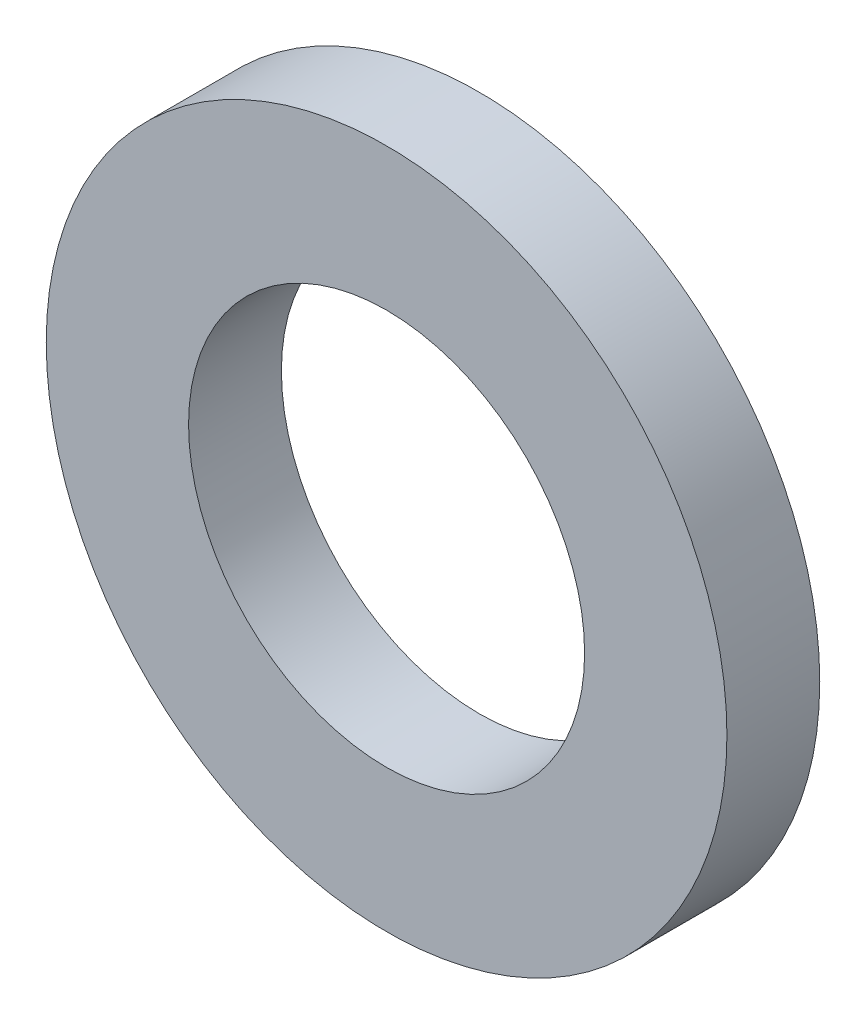
from build123d import *

# Parameters (mm, degrees)
SKETCH1_R           = 5.5
SKETCH1_R_2         = 3.2
BOSS_EXTRUDE1_DEPTH = 1.5


with BuildPart() as part:
    # Sketch1 → Boss-Extrude1 (new body)
    with BuildSketch(Plane.XY):
        Circle(SKETCH1_R)
        Circle(SKETCH1_R_2, mode=Mode.SUBTRACT)
    extrude(amount=BOSS_EXTRUDE1_DEPTH)


solid = part.part
